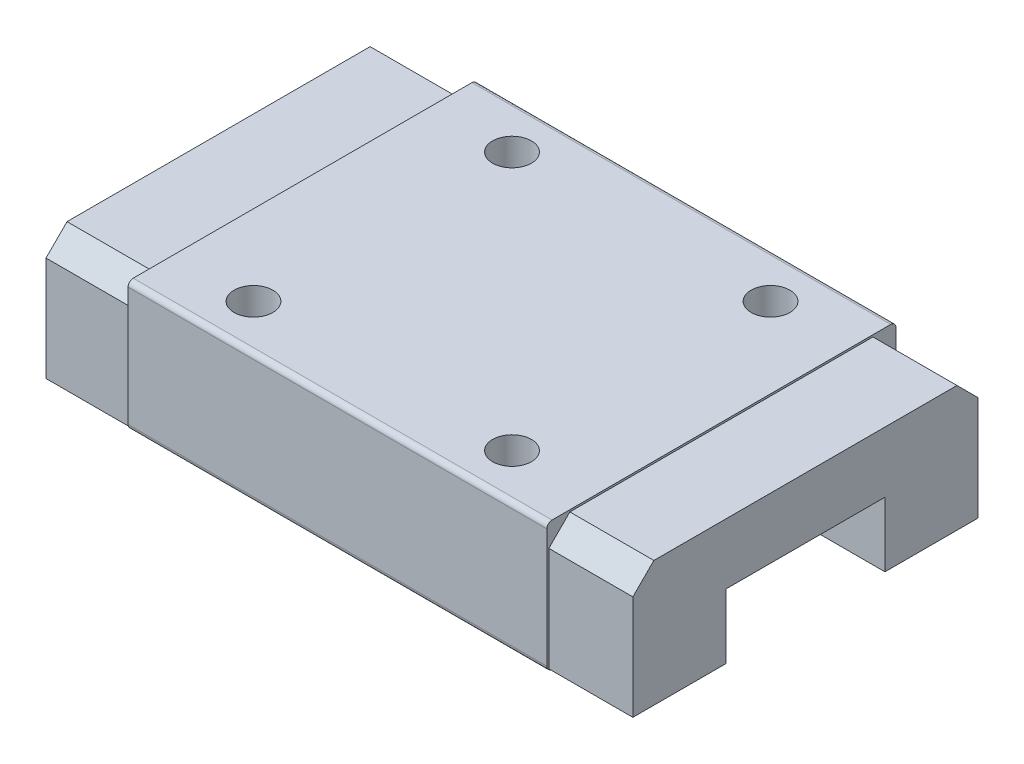
from build123d import *

# Parameters (mm, degrees)
BOSS_EXTRUDE1_DEPTH      = 16.2
BOSS_EXTRUDE1_DEPTH_BACK = 16.2
SKETCH2_R                = 1.5
CUT_EXTRUDE1_DEPTH       = 5
BOSS_EXTRUDE2_DEPTH      = 6.5
BOSS_EXTRUDE3_DEPTH      = 6.5
FILLET1_R                = 0.4


with BuildPart() as part:
    # Sketch1 → Boss-Extrude1 (new, two sides: drawn at the far end of the back side and taken through both)
    with BuildSketch(Plane(origin=(0, 0, 0), x_dir=(0, 0, -1), z_dir=(1, 0, 0)).offset(-BOSS_EXTRUDE1_DEPTH_BACK)):
        Polygon((13.5, 0), (-13.5, 0), (-13.5, -10), (-6, -10), (-6, -5), (6, -5), (6, -10), (13.5, -10), align=None)
    extrude(amount=BOSS_EXTRUDE1_DEPTH + BOSS_EXTRUDE1_DEPTH_BACK)

    # Sketch2 → Cut-Extrude1 (cut)
    with BuildSketch(Plane(origin=(0, 0, 0), x_dir=(1, 0, 0), z_dir=(0, 1, 0))):
        with Locations((-10, 10)):
            Circle(SKETCH2_R)
        with Locations((-10, -10)):
            Circle(SKETCH2_R)
        with Locations((10, -10)):
            Circle(SKETCH2_R)
        with Locations((10, 10)):
            Circle(SKETCH2_R)
    extrude(amount=-CUT_EXTRUDE1_DEPTH, mode=Mode.SUBTRACT)

    # Fillet1
    fillet1_edges = [part.edges().sort_by_distance(p)[0] for p in [
        (0, -10, -13.5),
        (0, 0, -13.5),
        (0, -10, 13.5),
        (0, 0, 13.5),
    ]]
    fillet(fillet1_edges, radius=FILLET1_R)


with BuildPart() as body_2:
    # Sketch3 → Boss-Extrude2 (new body)
    with BuildSketch(Plane.ZY.offset(16.2)):
        Polygon((-13.35, -1.776345597), (-11.723654403, -0.15), (11.723654403, -0.15), (13.35, -1.776345597), (13.35, -9.85), (6.15, -9.85), (6.15, -4.85), (-6.15, -4.85), (-6.15, -9.85), (-13.35, -9.85), align=None)
    extrude(amount=BOSS_EXTRUDE2_DEPTH)


with BuildPart() as body_3:
    # Sketch4 → Boss-Extrude3 (new body)
    with BuildSketch(Plane(origin=(16.2, 0, 0), x_dir=(0, 0, -1), z_dir=(1, 0, 0))):
        Polygon((13.35, -1.776345597), (11.723654403, -0.15), (-11.723654403, -0.15), (-13.35, -1.776345597), (-13.35, -9.85), (-6.15, -9.85), (-6.15, -4.85), (6.15, -4.85), (6.15, -9.85), (13.35, -9.85), align=None)
    extrude(amount=BOSS_EXTRUDE3_DEPTH)


solid = Compound([part.part, body_2.part, body_3.part])
